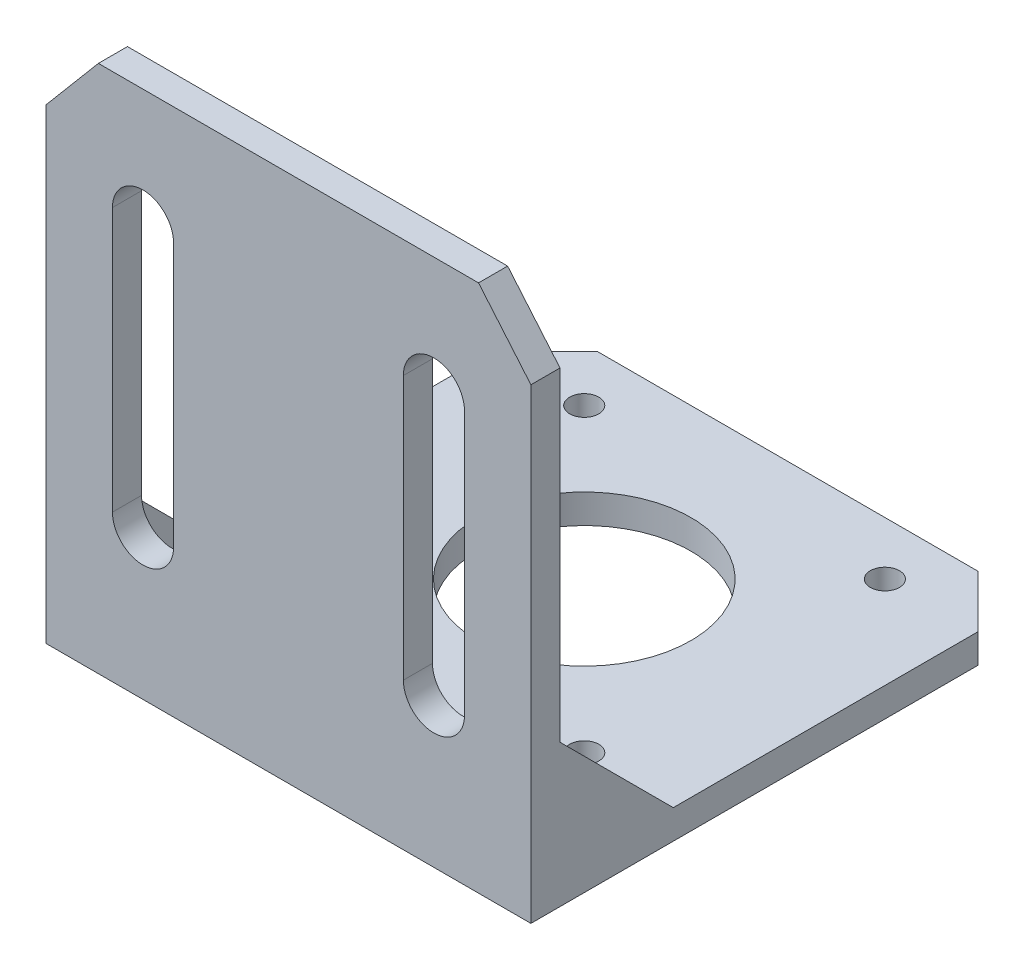
from build123d import *

# Parameters (mm, degrees)
SKETCH_1_R      = 1.5
SKETCH_1_R_2    = 11
EXTRUDE_1_DEPTH = 3
EXTRUDE_2_DEPTH = 3
RIB_2_REACH     = 81.244
SKETCH_4_WALL_W = 177.006790998
SKETCH_4_WALL_H = 3


with BuildPart() as part:
    # 草图1 → 凸台-拉伸1 (new body)
    with BuildSketch(Plane(origin=(0, 0, 0), x_dir=(1, 0, 0), z_dir=(0, 1, 0))):
        Polygon((-25, -23.05), (25, -23.05), (25, 23.05), (19.6, 28.45), (-19.6, 28.45), (-25, 23.05), align=None)
        with Locations(Location((-15.5, 22.95, 0), (0, 0, 270))):
            Circle(SKETCH_1_R, mode=Mode.SUBTRACT)
        with Locations(Location((15.5, 22.95, 0), (0, 0, 90))):
            Circle(SKETCH_1_R, mode=Mode.SUBTRACT)
        with Locations(Location((-15.5, -8.05, 0), (0, 0, 270))):
            Circle(SKETCH_1_R, mode=Mode.SUBTRACT)
        with Locations(Location((15.5, -8.05, 0), (0, 0, 90))):
            Circle(SKETCH_1_R, mode=Mode.SUBTRACT)
        with Locations(Location((0, 7.45, 0), (0, 0, 270))):
            Circle(SKETCH_1_R_2, mode=Mode.SUBTRACT)
    extrude(amount=EXTRUDE_1_DEPTH)

    # 草图3 → 凸台-拉伸2 (add)
    with BuildSketch(Plane.XY.offset(23.05)):
        Polygon((25, 0), (-25, 0), (-25, 48.1), (-19.6, 54.5), (19.6, 54.5), (25, 48.1), align=None)
        with BuildLine():
            Line((-11.85, 42.35), (-11.85, 15.15))
            ThreePointArc((-11.85, 15.15), (-15, 12), (-18.15, 15.15))
            Line((-18.15, 15.15), (-18.15, 42.35))
            ThreePointArc((-18.15, 42.35), (-15, 45.5), (-11.85, 42.35))
        make_face(mode=Mode.SUBTRACT)
        with BuildLine():
            Line((11.85, 42.35), (11.85, 15.15))
            ThreePointArc((11.85, 15.15), (15, 12), (18.15, 15.15))
            Line((18.15, 15.15), (18.15, 42.35))
            ThreePointArc((18.15, 42.35), (15, 45.5), (11.85, 42.35))
        make_face(mode=Mode.SUBTRACT)
    extrude(amount=-EXTRUDE_2_DEPTH)

    # 草图4 wall → 筋2 (add, up to next)
    with BuildSketch(Plane(origin=(-25, 8.840091802, 14.209908198), x_dir=(0, -0.707106781187, -0.707106781187), z_dir=(0, -0.707106781187, 0.707106781187)), mode=Mode.PRIVATE) as rib_2_sk1:
        with Locations((0, 1.5)):
            Rectangle(SKETCH_4_WALL_W, SKETCH_4_WALL_H)
    rib_2_tool1 = extrude(rib_2_sk1.sketch, amount=RIB_2_REACH, mode=Mode.PRIVATE) - part.part
    rib_2 = rib_2_tool1.solids().sort_by_distance((-25, 8.840091802, 14.209908198))[0]
    add(rib_2)

    # 镜向1: 筋2 across plane
    add(rib_2.mirror(Plane(origin=(0, 0, 0), x_dir=(0, 0, 1), z_dir=(1, 0, 0))))


solid = part.part
